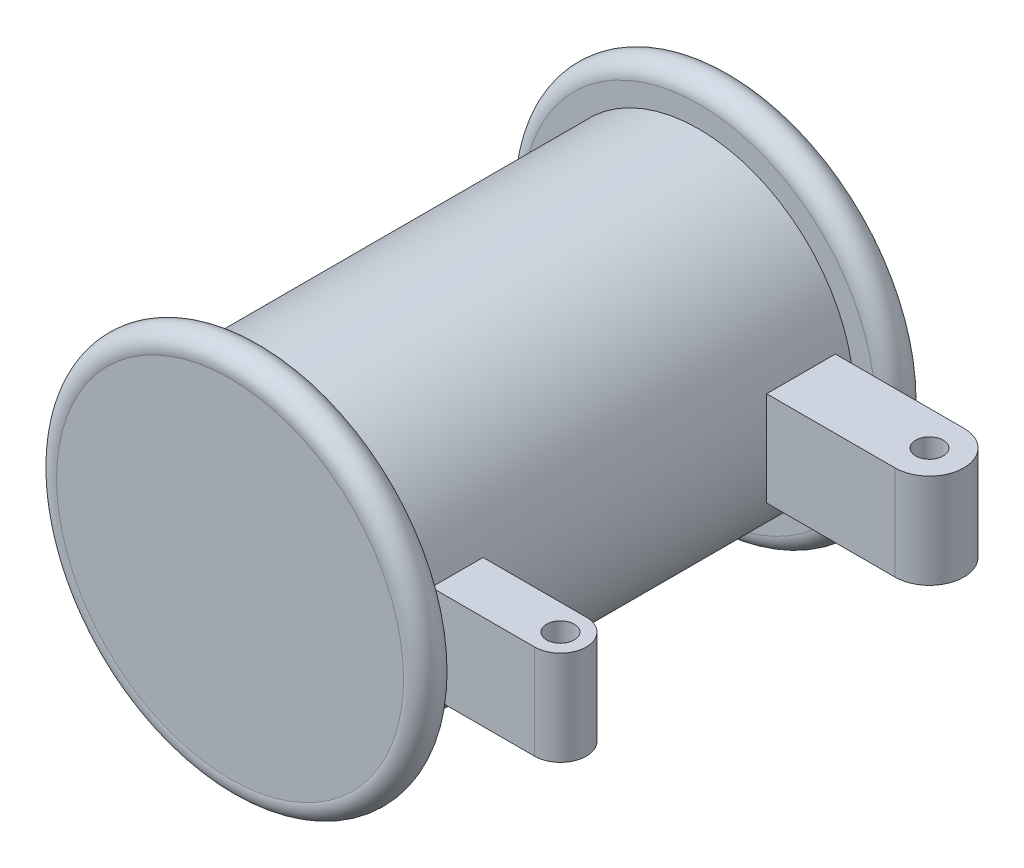
from build123d import *

# Parameters (mm, degrees)
SKETCH3_R             = 0.1
BOSS_EXTRUDE2_DEPTH   = 0.344
BOSS_EXTRUDE2_2_DEPTH = 0.344


with BuildPart() as part:
    # Sketch1 → Revolve3 (revolve)
    with BuildSketch(Plane(origin=(0, 0, 0), x_dir=(1, 0, 0), z_dir=(0, 1, 0))):
        with BuildLine():
            Line((4.535, 3.408), (4.379, 3.408))
            Line((4.379, 3.408), (4.379, 0.24154255))
            Line((4.379, 0.24154255), (4.535615917, 0.24154255))
            ThreePointArc((4.535615917, 0.24154255), (4.657, 0.107299003), (4.511252446, 0))
            Line((4.511252446, 0), (3.25, 0))
            Line((3.25, 0), (3.25, 3.652))
            Line((3.25, 3.652), (4.535, 3.652))
            ThreePointArc((4.535, 3.652), (4.657, 3.53), (4.535, 3.408))
        make_face()
    revolve(axis=Axis((3.25, 0, 0), (0, 0, -1)))


with BuildPart() as body_2:
    # Sketch3 → Boss-Extrude2 (new, symmetric)
    with BuildSketch(Plane(origin=(0, 0, 0), x_dir=(1, 0, 0), z_dir=(0, 1, 0))):
        with BuildLine():
            Line((5.13, 0.71), (4.379, 0.71))
            Line((4.379, 0.71), (4.379, 0.334))
            Line((4.379, 0.334), (5.13, 0.334))
            ThreePointArc((5.13, 0.334), (5.318, 0.522), (5.13, 0.71))
        make_face()
        with Locations(Location((5.13, 0.522, 0), (0, 0, 270))):
            Circle(SKETCH3_R, mode=Mode.SUBTRACT)
    extrude(amount=BOSS_EXTRUDE2_DEPTH, both=True)


with BuildPart() as body_3:
    # Sketch3 → Boss-Extrude2 2 (new, symmetric)
    with BuildSketch(Plane(origin=(0, 0, 0), x_dir=(1, 0, 0), z_dir=(0, 1, 0))):
        with BuildLine():
            Line((5.313, 3.272), (4.379, 3.272))
            Line((4.379, 3.272), (4.379, 2.772))
            Line((4.379, 2.772), (5.313, 2.772))
            ThreePointArc((5.313, 2.772), (5.563, 3.022), (5.313, 3.272))
        make_face()
        with Locations(Location((5.313, 3.022, 0), (0, 0, 270))):
            Circle(SKETCH3_R, mode=Mode.SUBTRACT)
    extrude(amount=BOSS_EXTRUDE2_2_DEPTH, both=True)


solid = Compound([part.part, body_2.part, body_3.part])
